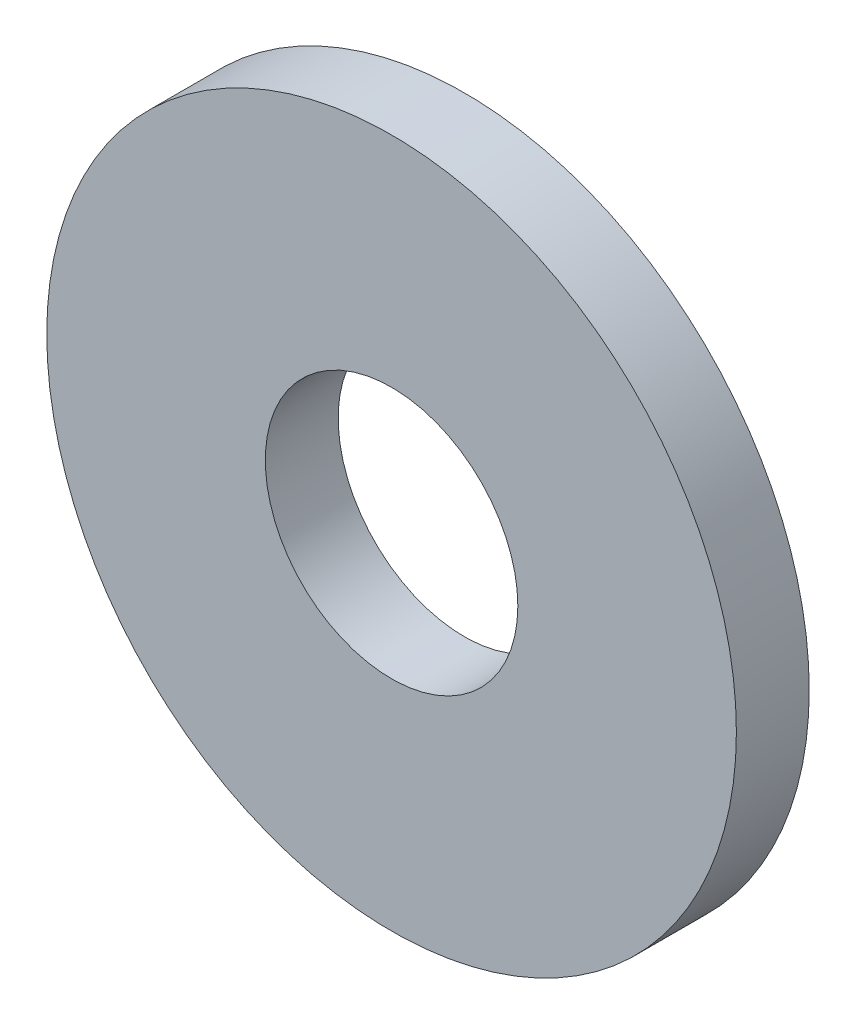
from build123d import *

# Parameters (mm, degrees)
SCHIZZO1_R                   = 71
SCHIZZO1_R_2                 = 26
ESTRUSIONE_ESTRUSIONE1_DEPTH = 15


with BuildPart() as part:
    # Schizzo1 → Estrusione-Estrusione1 (new body)
    with BuildSketch(Plane.XY):
        Circle(SCHIZZO1_R)
        Circle(SCHIZZO1_R_2, mode=Mode.SUBTRACT)
    extrude(amount=ESTRUSIONE_ESTRUSIONE1_DEPTH)


solid = part.part
